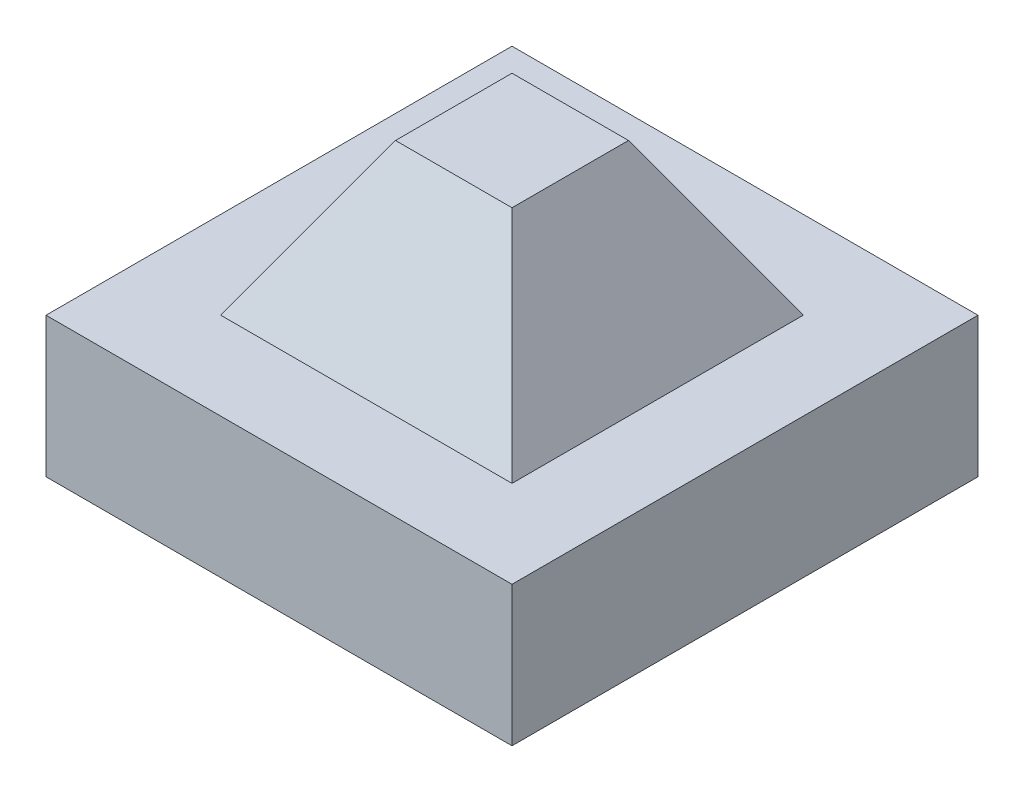
from build123d import *

# Parameters (mm, degrees)
SKETCH_1_W               = 800
SKETCH_1_H               = 800
EXTRUDE_1_DEPTH          = 500
CUT_EXTRUDE_1_DEPTH      = 1025.695076596
CUT_EXTRUDE_1_DEPTH_BACK = 1025.695076596
CUT_EXTRUDE_2_DEPTH      = 1025.695076596
CUT_EXTRUDE_2_DEPTH_BACK = 1025.695076596


with BuildPart() as part:
    # 草图1 → 凸台-拉伸1 (new body)
    with BuildSketch(Plane(origin=(0, 0, 0), x_dir=(1, 0, 0), z_dir=(0, 1, 0))):
        Rectangle(SKETCH_1_W, SKETCH_1_H)
    extrude(amount=EXTRUDE_1_DEPTH)

    # 草图2 → 切除-拉伸1 (cut, two sides: drawn at the far end of the back side and taken through both)
    with BuildSketch(Plane.ZY.offset(400).offset(-CUT_EXTRUDE_1_DEPTH_BACK)):
        Polygon((-400, 240.192378865), (-250, 240.192378865), (-100, 500), (-400, 500), align=None)
        Polygon((250, 240.192378865), (100, 500), (400, 500), (400, 240.192378865), align=None)
    extrude(amount=CUT_EXTRUDE_1_DEPTH + CUT_EXTRUDE_1_DEPTH_BACK, mode=Mode.SUBTRACT)

    # 草图3 → 切除-拉伸2 (cut, two sides: drawn at the far end of the back side and taken through both)
    with BuildSketch(Plane(origin=(0, 0, -400), x_dir=(-1, 0, 0), z_dir=(0, 0, -1)).offset(-CUT_EXTRUDE_2_DEPTH_BACK)):
        Polygon((-400, 240.192378865), (-250, 240.192378865), (-100, 500), (-400, 500), align=None)
        Polygon((250, 240.192378865), (100, 500), (400, 500), (400, 240.192378865), align=None)
    extrude(amount=CUT_EXTRUDE_2_DEPTH + CUT_EXTRUDE_2_DEPTH_BACK, mode=Mode.SUBTRACT)


solid = part.part
